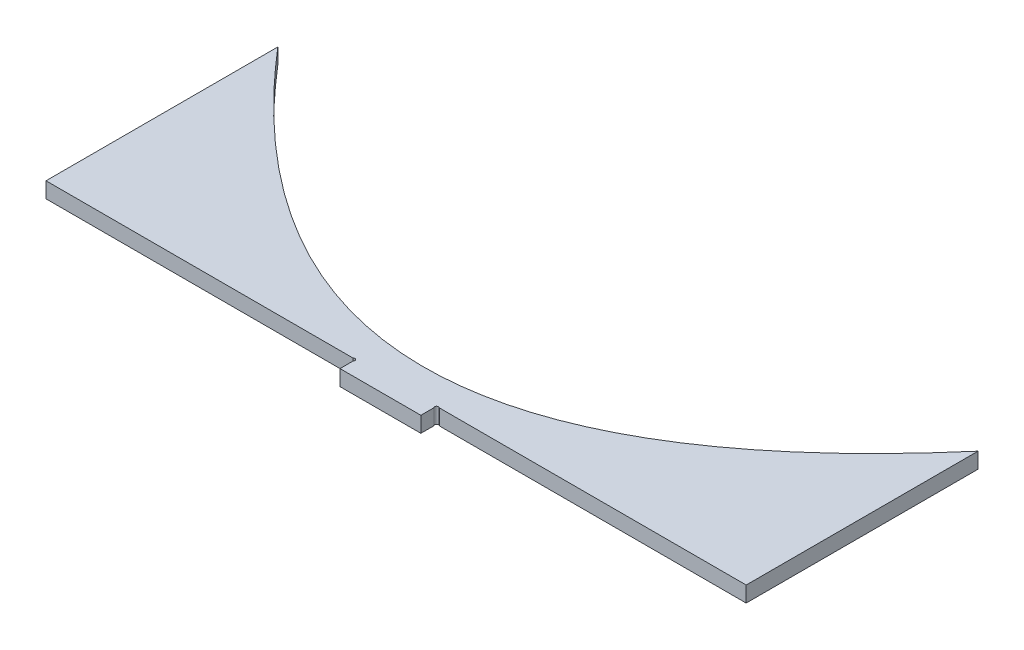
from build123d import *

# Parameters (mm, degrees)
SALIENTE_EXTRUIR1_DEPTH = 12


with BuildPart() as part:
    # Croquis1 → Saliente-Extruir1 (new body)
    with BuildSketch(Plane(origin=(0, 0, 0), x_dir=(1, 0, 0), z_dir=(0, 1, 0))):
        with BuildLine():
            Line((-237.438208893, 168.650156508), (-237.438208893, -9.106373442))
            Line((-237.438208893, -9.106373442), (-2.121320344, -9.106373442))
            ThreePointArc((-2.121320344, -9.106373442), (0, -9.106373442), (0, -11.227693785))
            Line((0, -11.227693785), (0, -21.106373442))
            Line((0, -21.106373442), (31, -21.106373442))
            Line((31, -21.106373442), (62, -21.106373442))
            Line((62, -21.106373442), (62, -11.227693785))
            ThreePointArc((62, -11.227693785), (62, -9.106373442), (64.121320344, -9.106373442))
            Line((64.121320344, -9.106373442), (299.438208893, -9.106373442))
            Line((299.438208893, -9.106373442), (299.438208893, 168.650156508))
            add(Edge.make_bspline(
                [(299.438208893, 168.650156508), (165.219104447, 12), (31, 12)],
                knots=[0, 0, 0, 1, 1, 1], degree=2))
            add(Edge.make_bspline(
                [(31, 12), (-103.219104447, 12), (-237.438208893, 168.650156508)],
                knots=[0, 0, 0, 1, 1, 1], degree=2))
        make_face()
    extrude(amount=SALIENTE_EXTRUIR1_DEPTH)


solid = part.part
